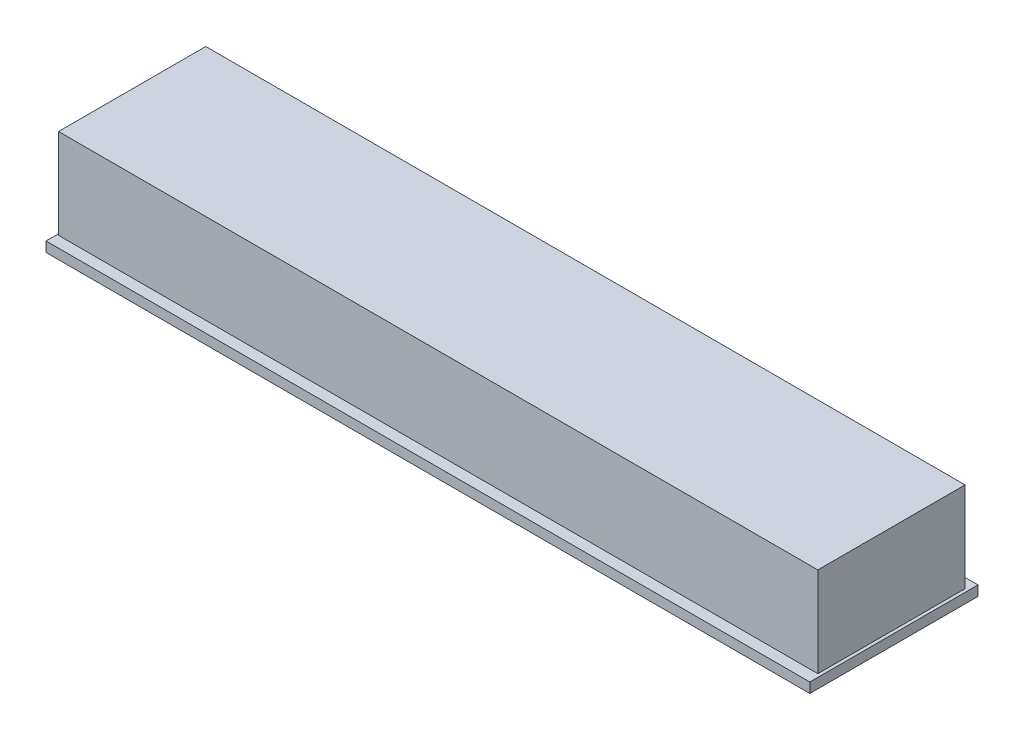
from build123d import *

# Parameters (mm, degrees)
SKETCH1_W           = 76.454565701
SKETCH1_H           = 16.829621381
BOSS_EXTRUDE1_DEPTH = 1
SKETCH3_W           = 76
SKETCH3_H           = 14.736718314
BOSS_EXTRUDE2_DEPTH = 10
SCALE1_SCALE        = 0.2


with BuildPart() as part:
    # Sketch1 → Boss-Extrude1 (new body)
    with BuildSketch(Plane(origin=(0, 0, 0), x_dir=(1, 0, 0), z_dir=(0, 1, 0))):
        with Locations((-6.298094695, 43.757015591)):
            Rectangle(SKETCH1_W, SKETCH1_H)
    extrude(amount=BOSS_EXTRUDE1_DEPTH)

    # Sketch3 → Boss-Extrude2 (add)
    with BuildSketch(Plane(origin=(0, 0, 0), x_dir=(1, 0, 0), z_dir=(0, 1, 0))):
        with Locations((-6.386632835, 43.82550718)):
            Rectangle(SKETCH3_W, SKETCH3_H)
    extrude(amount=BOSS_EXTRUDE2_DEPTH)


with BuildPart() as part_1:
    # Scale1: scaled about (-6.376610315, 4.933999832, -43.81775393)
    add(part.part.scale(SCALE1_SCALE).moved(Location((-5.101288252, 3.947199866, -35.054203144))))


solid = part_1.part
